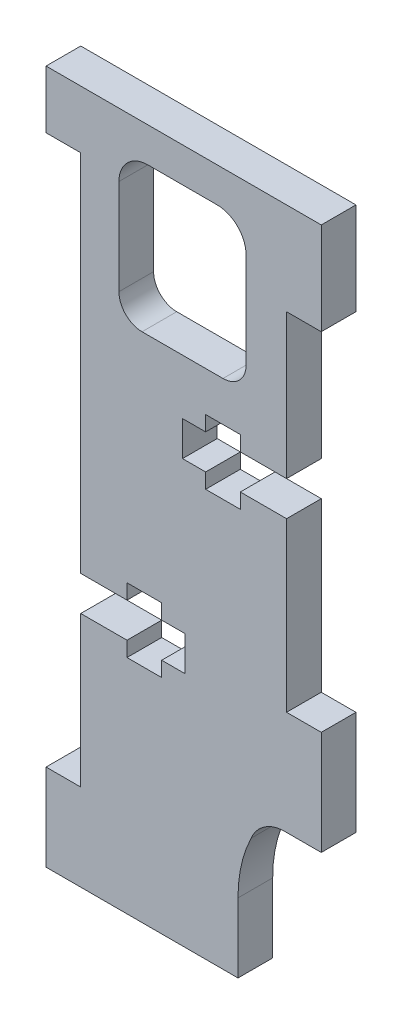
from build123d import *

# Parameters (mm, degrees)
EXTRUDE_1_DEPTH = 3


with BuildPart() as part:
    # 草圖1 → 填料-伸長1 (new body)
    with BuildSketch(Plane.XY):
        with BuildLine():
            Line((277.0002, 51.487966928), (273.0002, 51.487966928))
            Line((273.0002, 51.487966928), (273.0002, 82.987966928))
            Line((273.0002, 82.987966928), (270.0002, 82.987966928))
            Line((270.0002, 82.987966928), (270.0002, 87.987966928))
            Line((270.0002, 87.987966928), (293.8002, 87.987966928))
            Line((293.8002, 87.987966928), (293.8002, 79.987966928))
            Line((293.8002, 79.987966928), (290.8002, 79.987966928))
            Line((290.8002, 79.987966928), (290.8002, 67.487966928))
            Line((290.8002, 67.487966928), (286.8002, 67.487966928))
            Line((286.8002, 67.487966928), (286.8002, 68.787966928))
            Line((286.8002, 68.787966928), (283.8002, 68.787966928))
            Line((283.8002, 68.787966928), (283.8002, 67.487966928))
            Line((283.8002, 67.487966928), (281.8002, 67.487966928))
            Line((281.8002, 67.487966928), (281.8002, 64.487966928))
            Line((281.8002, 64.487966928), (283.8002, 64.487966928))
            Line((283.8002, 64.487966928), (283.8002, 63.187966928))
            Line((283.8002, 63.187966928), (286.8002, 63.187966928))
            Line((286.8002, 63.187966928), (286.8002, 64.487966928))
            Line((286.8002, 64.487966928), (290.8002, 64.487966928))
            Line((290.8002, 64.487966928), (290.8002, 49.987966928))
            Line((290.8002, 49.987966928), (293.8002, 49.987966928))
            Line((293.8002, 49.987966928), (293.8002, 40.987966928))
            Line((293.8002, 40.987966928), (290.5767, 40.987966928))
            ThreePointArc((290.5767, 40.987966928), (288.86822917, 40.432160329), (287.739170718, 39.034655209))
            ThreePointArc((287.739170718, 39.034655209), (286.880429852, 36.576592206), (286.6002, 33.987966928))
            Line((286.6002, 33.987966928), (286.6002, 27.987966928))
            Line((286.6002, 27.987966928), (269.998800526, 27.987966928))
            Line((269.998800526, 27.987966928), (270.0002, 35.487966928))
            Line((270.0002, 35.487966928), (273.0002, 35.487966928))
            Line((273.0002, 35.487966928), (273.0002, 48.487966928))
            Line((273.0002, 48.487966928), (277.0002, 48.487966928))
            Line((277.0002, 48.487966928), (277.0002, 47.187966928))
            Line((277.0002, 47.187966928), (280.0002, 47.187966928))
            Line((280.0002, 47.187966928), (280.0002, 48.487966928))
            Line((280.0002, 48.487966928), (282.0002, 48.487966928))
            Line((282.0002, 48.487966928), (282.0002, 51.487966928))
            Line((282.0002, 51.487966928), (280.0002, 51.487966928))
            Line((280.0002, 51.487966928), (280.0002, 52.787966928))
            Line((280.0002, 52.787966928), (277.0002, 52.787966928))
            Line((277.0002, 52.787966928), (277.0002, 51.487966928))
        make_face()
        with BuildLine():
            Line((284.8002, 84.987966928), (278.8002, 84.987966928))
            ThreePointArc((278.8002, 84.987966928), (277.03241875, 84.255748178), (276.3002, 82.487966928))
            Line((276.3002, 82.487966928), (276.3002, 74.237966928))
            ThreePointArc((276.3002, 74.237966928), (276.885985355, 72.823781571), (278.3002, 72.238066928))
            Line((278.3002, 72.238066928), (285.3002, 72.238066928))
            ThreePointArc((285.3002, 72.238066928), (286.714464642, 72.823731571), (287.3002, 74.237966928))
            Line((287.3002, 74.237966928), (287.3002, 82.487966928))
            ThreePointArc((287.3002, 82.487966928), (286.568, 84.255766928), (284.8002, 84.987966928))
        make_face(mode=Mode.SUBTRACT)
    extrude(amount=EXTRUDE_1_DEPTH)


solid = part.part
